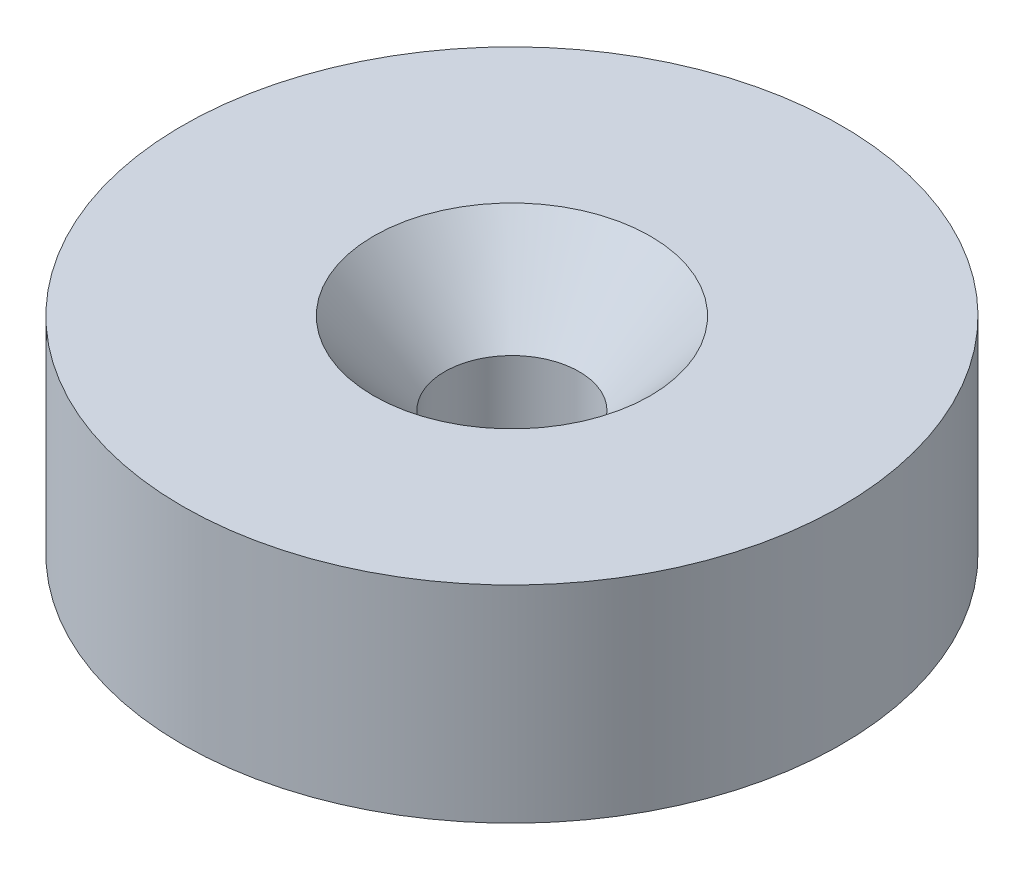
from build123d import *

# Parameters (mm, degrees)
SKETCH1_R                                          = 12.7
EXTRUDE1_DEPTH                                     = 7.9502
CSK_FOR_10_FLAT_HEAD_MACHINE_SCREW_100_D           = 5.1816
CSK_FOR_10_FLAT_HEAD_MACHINE_SCREW_100_CSINK_D     = 10.6621834
CSK_FOR_10_FLAT_HEAD_MACHINE_SCREW_100_CSINK_ANGLE = 82


with BuildPart() as part:
    # Sketch1 → Extrude1 (new body)
    with BuildSketch(Plane(origin=(0, 0, 0), x_dir=(1, 0, 0), z_dir=(0, 1, 0))):
        with Locations(Location((0, 0, 0), (0, 0, 270))):
            Circle(SKETCH1_R)
    extrude(amount=EXTRUDE1_DEPTH)

    # CSK for #10 Flat Head Machine Screw (100)1 (through all)
    with Locations(Plane(origin=(0, 7.9502, 0), x_dir=(-1, 0, 0), z_dir=(0, 1, 0))):
        with Locations((0, 0)):
            CounterSinkHole(CSK_FOR_10_FLAT_HEAD_MACHINE_SCREW_100_D / 2, CSK_FOR_10_FLAT_HEAD_MACHINE_SCREW_100_CSINK_D / 2, counter_sink_angle=CSK_FOR_10_FLAT_HEAD_MACHINE_SCREW_100_CSINK_ANGLE)


solid = part.part
